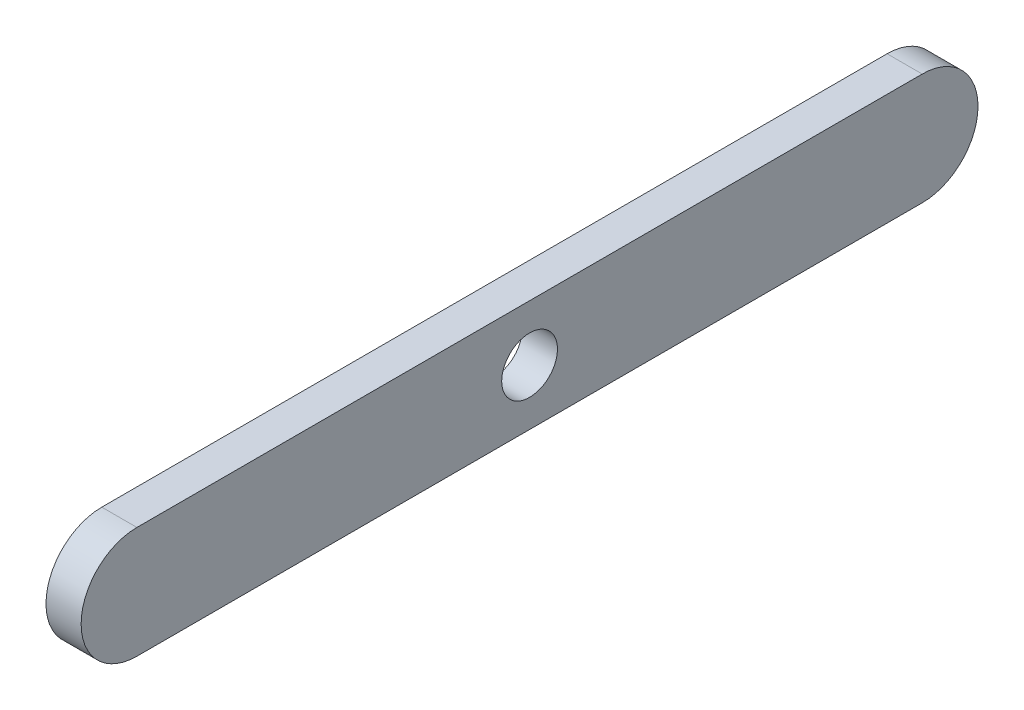
from build123d import *

# Parameters (mm, degrees)
SKETCH1_R           = 1.5875
BOSS_EXTRUDE1_DEPTH = 2


with BuildPart() as part:
    # Sketch1 → Boss-Extrude1 (new body)
    with BuildSketch(Plane(origin=(0, 0, 0), x_dir=(0, 0, -1), z_dir=(1, 0, 0))):
        with BuildLine():
            Line((33.525, 0), (-11.175, 0))
            ThreePointArc((-11.175, 0), (-14.35, 3.175), (-11.175, 6.35))
            Line((-11.175, 6.35), (33.525, 6.35))
            ThreePointArc((33.525, 6.35), (36.7, 3.175), (33.525, 0))
        make_face()
        with Locations(Location((11.175, 3.175, 0), (0, 0, 180))):
            Circle(SKETCH1_R, mode=Mode.SUBTRACT)
    extrude(amount=BOSS_EXTRUDE1_DEPTH)


solid = part.part
